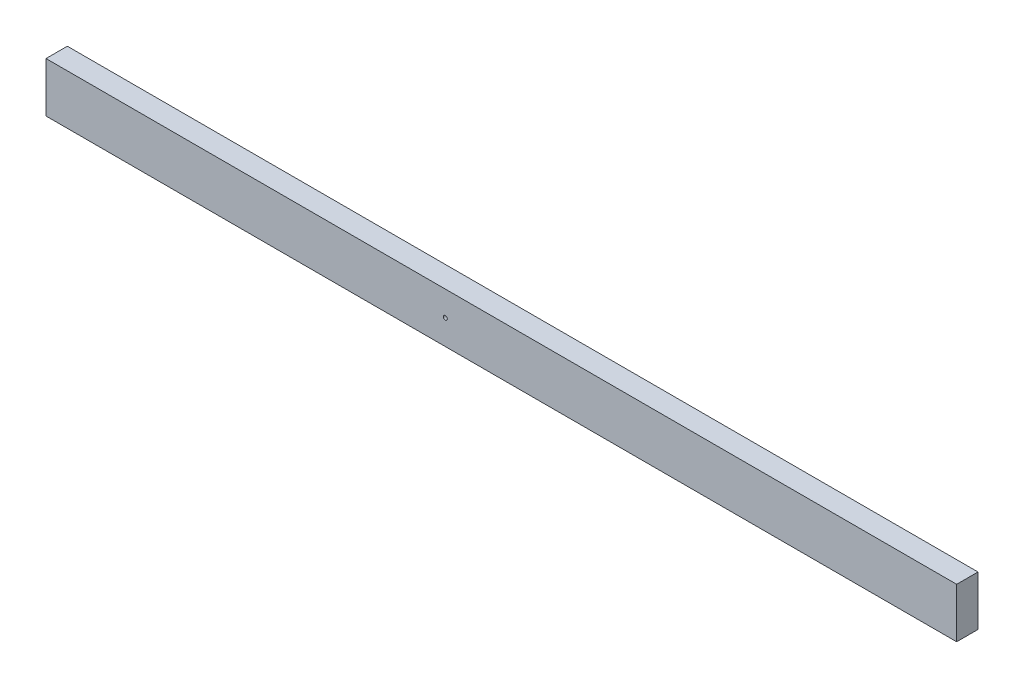
from build123d import *

# Parameters (mm, degrees)
SKETCH1_W                       = 38.1
SKETCH1_H                       = 88.9
BOSS_EXTRUDE1_DEPTH             = 1625.6
F_9_32_0_28125_DIAMETER_HOLE1_D = 7.14375


with BuildPart() as part:
    # Sketch1 → Boss-Extrude1 (new body)
    with BuildSketch(Plane(origin=(0, 0, 0), x_dir=(0, 0, -1), z_dir=(1, 0, 0))):
        Rectangle(SKETCH1_W, SKETCH1_H)
    extrude(amount=BOSS_EXTRUDE1_DEPTH)

    # 9/32 (0.28125) Diameter Hole1 (through all)
    with Locations(Plane.XY.offset(19.05)):
        with Locations((712.7875, 0)):
            Hole(F_9_32_0_28125_DIAMETER_HOLE1_D / 2)


solid = part.part
